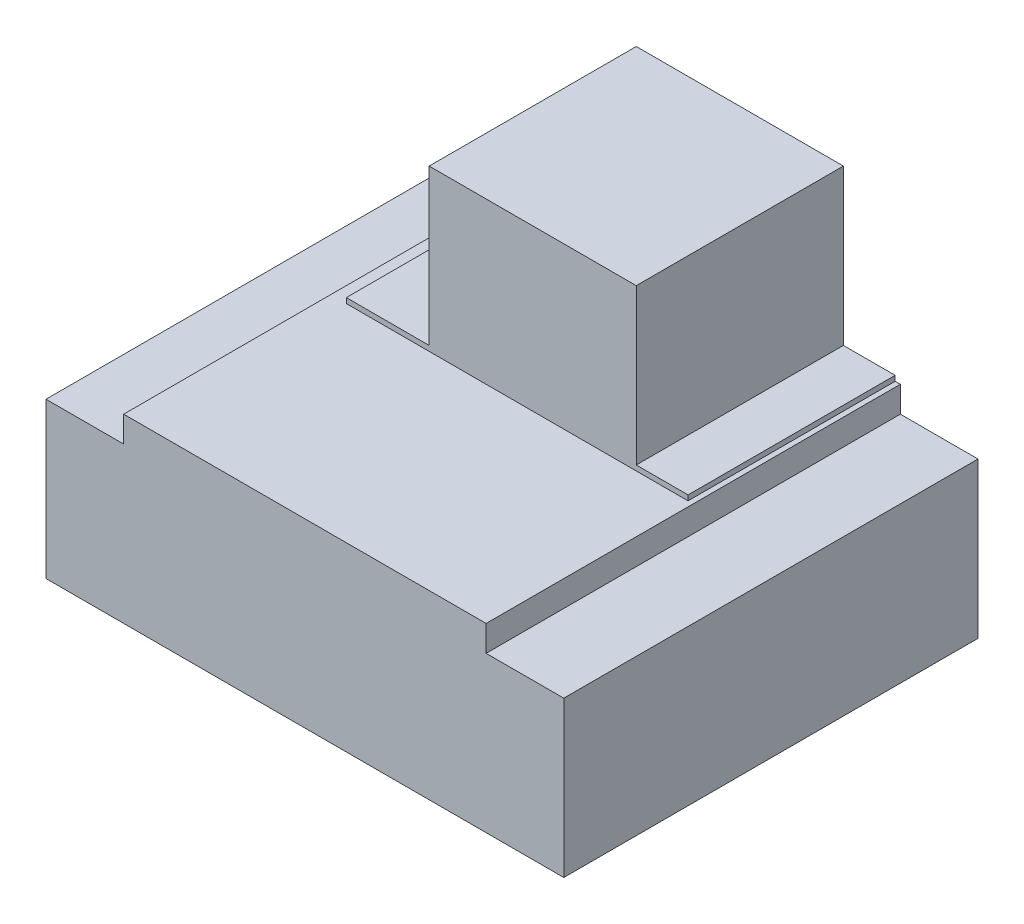
from build123d import *

# Parameters (mm, degrees)
SKETCH_1_W          = 100
SKETCH_1_H          = 80
EXTRUDE_1_DEPTH     = 35
SKETCH_2_W          = 66
SKETCH_2_H          = 40
EXTRUDE_2_DEPTH     = 1
SKETCH_3_W          = 40
SKETCH_3_H          = 40
EXTRUDE_3_DEPTH     = 30
SKETCH_4_W          = 15
SKETCH_4_H          = 80
CUT_EXTRUDE_1_DEPTH = 5


with BuildPart() as part:
    # 草图1 → 凸台-拉伸1 (new body)
    with BuildSketch(Plane(origin=(0, 0, 0), x_dir=(1, 0, 0), z_dir=(0, 1, 0))):
        with Locations((50, 40)):
            Rectangle(SKETCH_1_W, SKETCH_1_H)
    extrude(amount=EXTRUDE_1_DEPTH)

    # 草图2 → 凸台-拉伸2 (add)
    with BuildSketch(Plane(origin=(0, 35, 0), x_dir=(1, 0, 0), z_dir=(0, 1, 0))):
        with Locations((51, 60)):
            Rectangle(SKETCH_2_W, SKETCH_2_H)
    extrude(amount=EXTRUDE_2_DEPTH)

    # 草图3 → 凸台-拉伸3 (add)
    with BuildSketch(Plane(origin=(0, 36, 0), x_dir=(1, 0, 0), z_dir=(0, 1, 0))):
        with Locations((54, 60)):
            Rectangle(SKETCH_3_W, SKETCH_3_H)
    extrude(amount=EXTRUDE_3_DEPTH)

    # 草图4 → 切除-拉伸1 (cut)
    with BuildSketch(Plane(origin=(0, 35, 0), x_dir=(1, 0, 0), z_dir=(0, 1, 0))):
        with Locations((7.5, 40)):
            Rectangle(SKETCH_4_W, SKETCH_4_H)
        with Locations((92.5, 40)):
            Rectangle(SKETCH_4_W, SKETCH_4_H)
    extrude(amount=-CUT_EXTRUDE_1_DEPTH, mode=Mode.SUBTRACT)


solid = part.part
